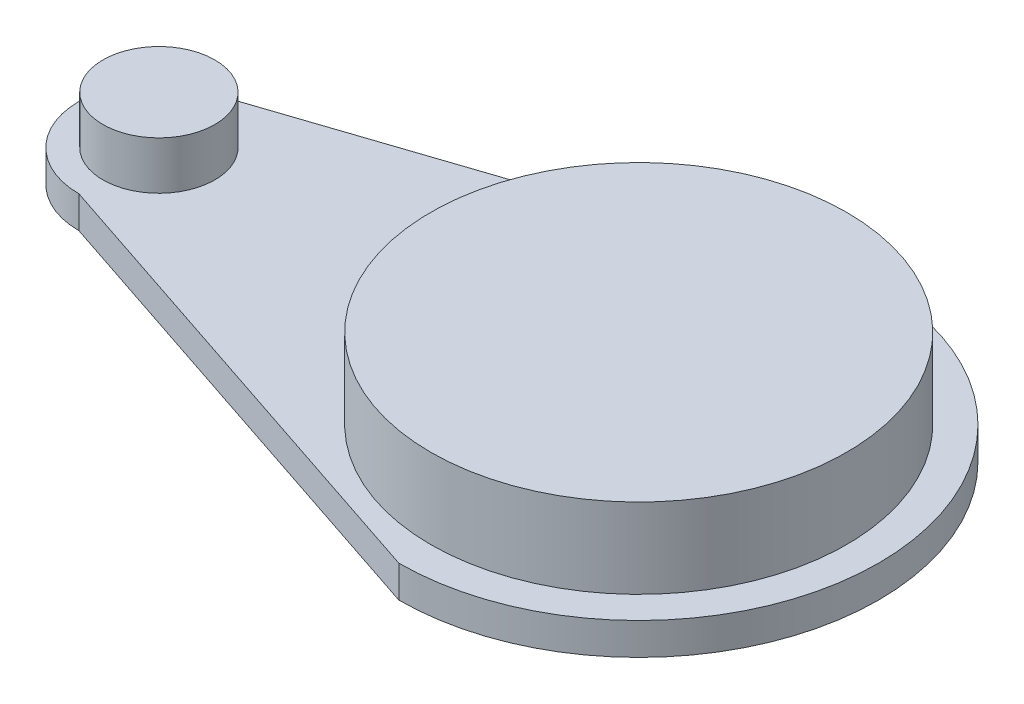
from build123d import *

# Parameters (mm, degrees)
BOSS_EXTRUDE1_DEPTH = 2.54
SKETCH2_R           = 16.51
BOSS_EXTRUDE2_DEPTH = 6.35
SKETCH3_R           = 4.445
BOSS_EXTRUDE3_DEPTH = 3.81


with BuildPart() as part:
    # Sketch1 → Boss-Extrude1 (new body)
    with BuildSketch(Plane(origin=(0, 0, 0), x_dir=(1, 0, 0), z_dir=(0, 1, 0))):
        with BuildLine():
            Line((0, 25.4), (38.1, 38.1))
            ThreePointArc((38.1, 38.1), (57.15, 19.05), (38.1, 0))
            Line((38.1, 0), (0, 12.7))
            ThreePointArc((0, 12.7), (-6.35, 19.05), (0, 25.4))
        make_face()
    extrude(amount=BOSS_EXTRUDE1_DEPTH)

    # Sketch2 → Boss-Extrude2 (add)
    with BuildSketch(Plane(origin=(0, 2.54, 0), x_dir=(1, 0, 0), z_dir=(0, 1, 0))):
        with Locations(Location((38.1, 19.05, 0), (0, 0, 90))):
            Circle(SKETCH2_R)
    extrude(amount=BOSS_EXTRUDE2_DEPTH)

    # Sketch3 → Boss-Extrude3 (add)
    with BuildSketch(Plane(origin=(0, 2.54, 0), x_dir=(1, 0, 0), z_dir=(0, 1, 0))):
        with Locations(Location((0, 19.05, 0), (0, 0, 90))):
            Circle(SKETCH3_R)
    extrude(amount=BOSS_EXTRUDE3_DEPTH)


solid = part.part
